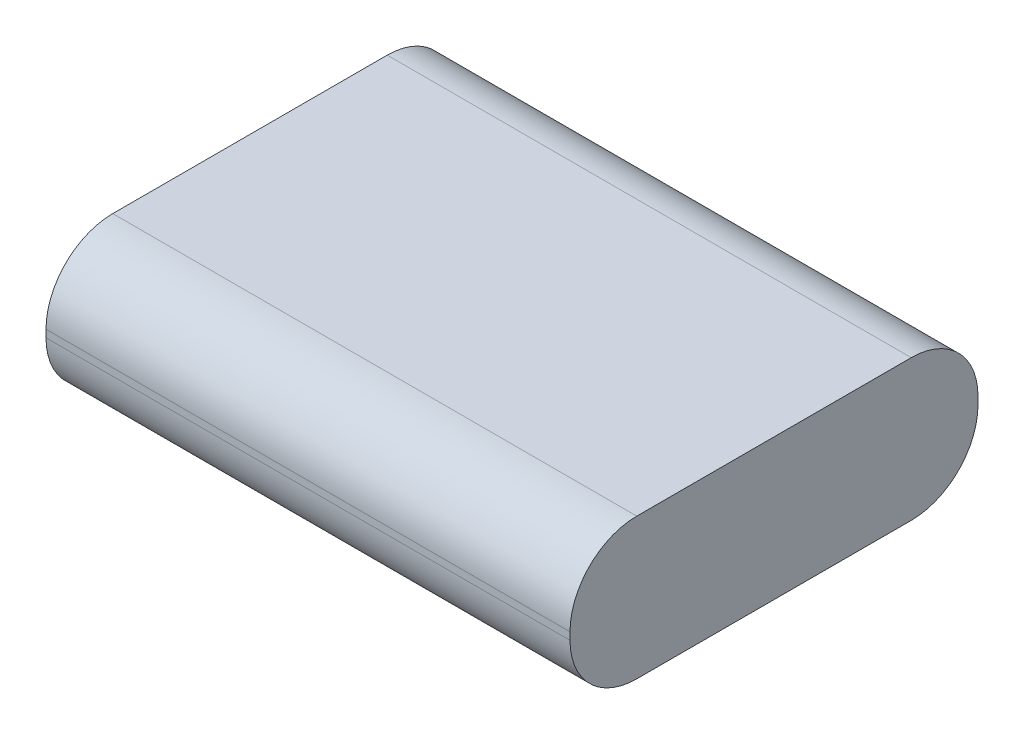
from build123d import *

# Parameters (mm, degrees)
SKETCH1_W           = 70.64
SKETCH1_H           = 55
BOSS_EXTRUDE1_DEPTH = 19
FILLET2_R           = 9
FILLET3_R           = 9
FILLET4_R           = 9
FILLET5_R           = 9


with BuildPart() as part:
    # Sketch1 → Boss-Extrude1 (new body)
    with BuildSketch(Plane(origin=(0, 0, 0), x_dir=(1, 0, 0), z_dir=(0, 1, 0))):
        with Locations((35.32, 27.5)):
            Rectangle(SKETCH1_W, SKETCH1_H)
    extrude(amount=BOSS_EXTRUDE1_DEPTH)

    # Fillet2
    fillet2_edges = [part.edges().sort_by_distance(p)[0] for p in [
        (35.32, 19, -55),
    ]]
    fillet(fillet2_edges, radius=FILLET2_R)

    # Fillet3
    fillet3_edges = [part.edges().sort_by_distance(p)[0] for p in [
        (35.32, 0, -55),
    ]]
    fillet(fillet3_edges, radius=FILLET3_R)

    # Fillet4
    fillet4_edges = [part.edges().sort_by_distance(p)[0] for p in [
        (35.32, 19, 0),
    ]]
    fillet(fillet4_edges, radius=FILLET4_R)

    # Fillet5
    fillet5_edges = [part.edges().sort_by_distance(p)[0] for p in [
        (35.32, 0, 0),
    ]]
    fillet(fillet5_edges, radius=FILLET5_R)


solid = part.part
